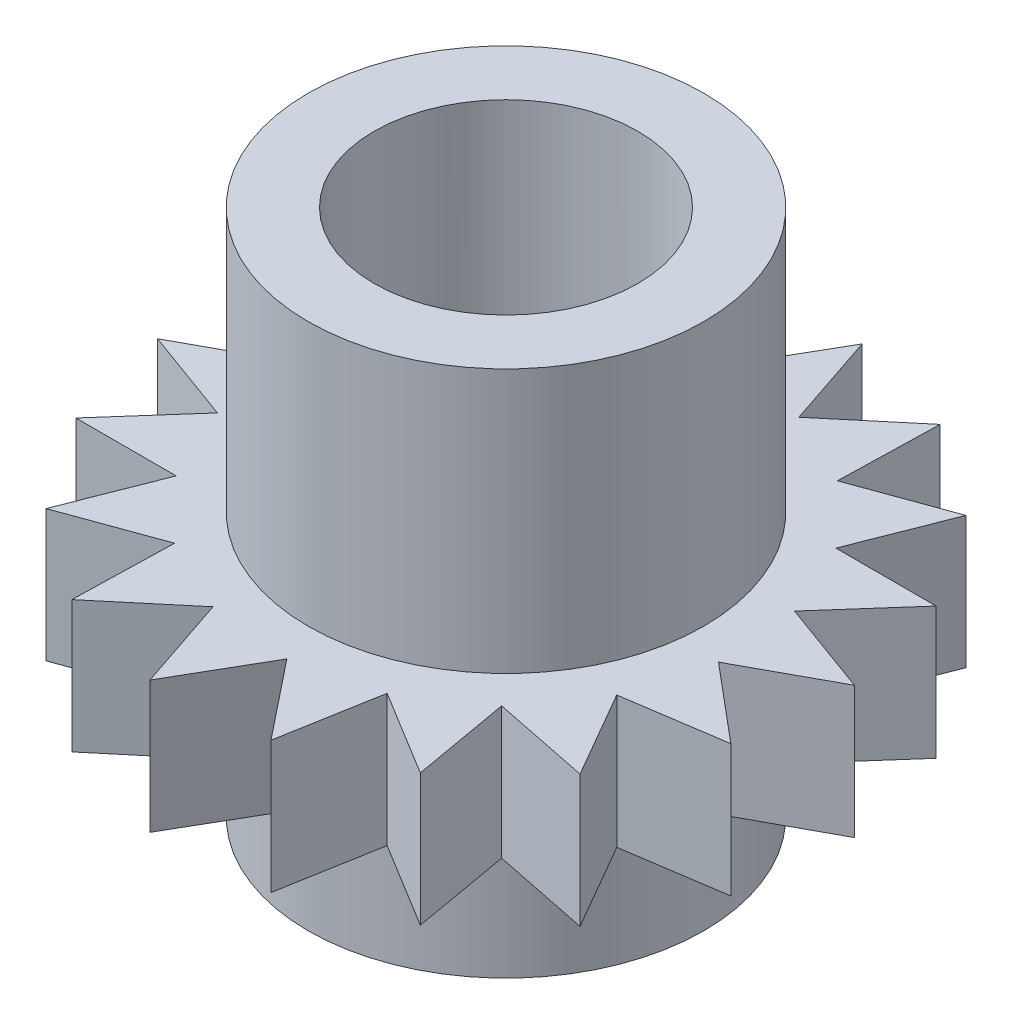
from build123d import *

# Parameters (mm, degrees)
SKETCH1_R           = 9
BOSS_EXTRUDE1_DEPTH = 5
SKETCH2_R           = 7.5
BOSS_EXTRUDE2_DEPTH = 10
SKETCH3_R           = 5
CUT_EXTRUDE1_DEPTH  = 20
SKETCH4_W           = 4
SKETCH4_H           = 2
BOSS_EXTRUDE3_DEPTH = 10


with BuildPart() as part:
    # Sketch1 → Boss-Extrude1 (new body)
    with BuildSketch(Plane(origin=(0, 0, 0), x_dir=(1, 0, 0), z_dir=(0, 1, 0))):
        Circle(SKETCH1_R)
        Polygon((-5.35288104, -11.104144955), (-5.256580304, -7.305365392), (-8.827904062, -8.603689933), (-7.438151841, -5.066941601), (-11.238151569, -5.065502929), (-8.72257249, -2.217369874), (-12.292912138, -0.916341513), (-8.954922165, 0.899649385), (-11.86496608, 3.343344214), (-8.107176067, 3.908157651), (-10.005930004, 7.199773285), (-6.281584886, 6.445284426), (-6.940031098, 10.187803442), (-3.698341861, 8.205014776), (-3.037062017, 11.947034147), (-0.669024226, 8.975099252), (1.232221565, 12.265276214), (2.440987604, 8.6626543), (5.35288104, 11.104144955), (5.256580304, 7.305365392), (8.827904062, 8.603689933), (7.438151841, 5.066941601), (11.238151569, 5.065502929), (8.72257249, 2.217369874), (12.292912138, 0.916341513), (8.954922165, -0.899649385), (11.86496608, -3.343344214), (8.107176067, -3.908157651), (10.005930004, -7.199773285), (6.281584886, -6.445284426), (6.940031098, -10.187803442), (3.698341861, -8.205014776), (3.037062017, -11.947034147), (0.669024226, -8.975099252), (-1.232221565, -12.265276214), (-2.440987604, -8.6626543), align=None)
    extrude(amount=BOSS_EXTRUDE1_DEPTH)

    # Sketch2 → Boss-Extrude2 (add, symmetric)
    with BuildSketch(Plane(origin=(0, 5, 0), x_dir=(1, 0, 0), z_dir=(0, 1, 0))):
        with Locations(Location((0, 0, 0), (0, 0, 270))):
            Circle(SKETCH2_R)
    extrude(amount=BOSS_EXTRUDE2_DEPTH, both=True)

    # Sketch3 → Cut-Extrude1 (cut)
    with BuildSketch(Plane(origin=(0, 15, 0), x_dir=(1, 0, 0), z_dir=(0, 1, 0))):
        with Locations(Location((0, 0, 0), (0, 0, 270))):
            Circle(SKETCH3_R)
    extrude(amount=-CUT_EXTRUDE1_DEPTH, mode=Mode.SUBTRACT)

    # Sketch4 → Boss-Extrude3 (add)
    with BuildSketch(Plane(origin=(0, 5, 0), x_dir=(1, 0, 0), z_dir=(0, 1, 0))):
        with Locations((0, 5)):
            Rectangle(SKETCH4_W, SKETCH4_H)
    extrude(amount=-BOSS_EXTRUDE3_DEPTH)


solid = part.part
